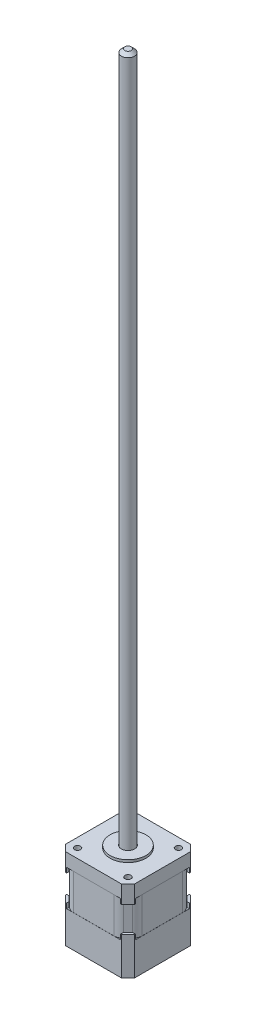
from build123d import *

# Parameters (mm, degrees)
ESBO_O1_W              = 42.3
ESBO_O1_H              = 42.3
UPPERBODY_DEPTH        = 8
CHANFRO1_SIZE          = 4
ESBO_O2_R              = 11
ESBO_O2_R_2            = 4.1
LITTLETOPCIRCLE_DEPTH  = 1.5
ESBO_O3_R              = 1.853680608
MOUNTINGHOLES_DEPTH    = 25
PADR_OCIRCULAR1_COUNT  = 4
LITTLEMETALTABS_DEPTH  = 3
PADR_OCIRCULAR2_COUNT  = 4
MIDDLEBODY_DEPTH       = 22
FILETE1_R              = 6
ESBO_O9_W              = 42.3
ESBO_O9_H              = 42.3
BOTTOMBODY_DEPTH       = 8
CHANFRO5_SIZE          = 4
LITTLEMETALTABS2_DEPTH = 3
PADR_OCIRCULAR3_COUNT  = 4
ESBO_O4_R              = 4
LEADSCREW_DEPTH        = 425
CHANFRO2_SIZE          = 2
EXTRUDE_1_DEPTH        = 12


with BuildPart() as part:
    # Esboço1 → UpperBody (new body)
    with BuildSketch(Plane(origin=(0, 0, 0), x_dir=(1, 0, 0), z_dir=(0, 1, 0))):
        Rectangle(ESBO_O1_W, ESBO_O1_H)
    extrude(amount=UPPERBODY_DEPTH)

    # Chanfro1
    chanfro1_edges = [part.edges().sort_by_distance(p)[0] for p in [
        (-21.15, 4, 21.15),
        (21.15, 4, -21.15),
        (-21.15, 4, -21.15),
        (21.15, 4, 21.15),
    ]]
    chamfer(chanfro1_edges, length=CHANFRO1_SIZE)

    # Esboço2 → LittleTopCircle (add)
    with BuildSketch(Plane(origin=(0, 8, 0), x_dir=(1, 0, 0), z_dir=(0, 1, 0))):
        Circle(ESBO_O2_R)
        Circle(ESBO_O2_R_2, mode=Mode.SUBTRACT)
    extrude(amount=LITTLETOPCIRCLE_DEPTH)

    # Esboço3 → MountingHoles (cut)
    with BuildSketch(Plane(origin=(0, 8, 0), x_dir=(1, 0, 0), z_dir=(0, 1, 0))):
        with Locations((-15.5, 15.5)):
            Circle(ESBO_O3_R)
    mountingholes = extrude(amount=-MOUNTINGHOLES_DEPTH, mode=Mode.SUBTRACT)

    # PadrãoCircular1: MountingHoles ×4 about axis
    padr_ocircular1_axis = Axis((0, 8, 0), (0, 1, 0))
    for i in range(1, PADR_OCIRCULAR1_COUNT):
        add(mountingholes.rotate(padr_ocircular1_axis, i * 360 / PADR_OCIRCULAR1_COUNT), mode=Mode.SUBTRACT)

    # Esboço7 → LittleMetalTabs (add)
    with BuildSketch(Plane.XZ):
        Polygon((-19.65, -16.528679656), (-21.15, -16.528679656), (-21.15, -17.15), (-17.15, -21.15), (-16.528679656, -21.15), (-16.528679656, -19.65), align=None)
    littlemetaltabs = extrude(amount=LITTLEMETALTABS_DEPTH)

    # PadrãoCircular2: LittleMetalTabs ×4 about axis
    padr_ocircular2_axis = Axis((0, 9.5, 0), (0, 1, 0))
    for i in range(1, PADR_OCIRCULAR2_COUNT):
        add(littlemetaltabs.rotate(padr_ocircular2_axis, i * 360 / PADR_OCIRCULAR2_COUNT))

    # Esboço8 → MiddleBody (add)
    with BuildSketch(Plane.XZ):
        Polygon((-14.9, 21.1), (14.9, 21.1), (21.1, 14.9), (21.1, -14.9), (14.9, -21.1), (-14.9, -21.1), (-21.1, -14.9), (-21.1, 14.9), align=None)
    extrude(amount=MIDDLEBODY_DEPTH)

    # Filete1
    filete1_edges = [part.edges().sort_by_distance(p)[0] for p in [
        (-21.1, -11, -14.9),
        (-21.1, -11, 14.9),
        (-14.9, -11, 21.1),
        (14.9, -11, 21.1),
        (-14.9, -11, -21.1),
        (21.1, -11, 14.9),
        (14.9, -11, -21.1),
        (21.1, -11, -14.9),
    ]]
    fillet(filete1_edges, radius=FILETE1_R)

    # Esboço9 → BottomBody (add)
    with BuildSketch(Plane.XZ.offset(22)):
        Rectangle(ESBO_O9_W, ESBO_O9_H)
    extrude(amount=BOTTOMBODY_DEPTH)

    # Chanfro5
    chanfro5_edges = [part.edges().sort_by_distance(p)[0] for p in [
        (21.15, -26, 21.15),
        (21.15, -26, -21.15),
        (-21.15, -26, 21.15),
        (-21.15, -26, -21.15),
    ]]
    chamfer(chanfro5_edges, length=CHANFRO5_SIZE)

    # Esboço10 → LittleMetalTabs2 (add)
    with BuildSketch(Plane(origin=(0, -22, 0), x_dir=(1, 0, 0), z_dir=(0, 1, 0))):
        Polygon((-16.528679656, -21.15), (-16.528679656, -19.65), (-19.65, -16.528679656), (-21.15, -16.528679656), (-21.15, -17.15), (-17.15, -21.15), align=None)
    littlemetaltabs2 = extrude(amount=LITTLEMETALTABS2_DEPTH)

    # PadrãoCircular3: LittleMetalTabs2 ×4 about axis
    padr_ocircular3_axis = Axis((0, -30, 0), (0, 1, 0))
    for i in range(1, PADR_OCIRCULAR3_COUNT):
        add(littlemetaltabs2.rotate(padr_ocircular3_axis, i * 360 / PADR_OCIRCULAR3_COUNT))

    # Esboço4 → LeadScrew (add)
    with BuildSketch(Plane(origin=(0, 8, 0), x_dir=(1, 0, 0), z_dir=(0, 1, 0))):
        Circle(ESBO_O4_R)
    extrude(amount=LEADSCREW_DEPTH)

    # Chanfro2
    chanfro2_edges = [part.edges().sort_by_distance(p)[0] for p in [
        (-4, 433, 0),
    ]]
    chamfer(chanfro2_edges, length=CHANFRO2_SIZE)

    # 草图6 → 凸台-拉伸1 (add)
    with BuildSketch(Plane.XZ.offset(30)):
        Polygon((21.15, -17.15), (21.15, 17.15), (17.15, 21.15), (-17.15, 21.15), (-21.15, 17.15), (-21.15, -17.15), (-17.15, -21.15), (17.15, -21.15), align=None)
    extrude(amount=EXTRUDE_1_DEPTH)


solid = part.part
